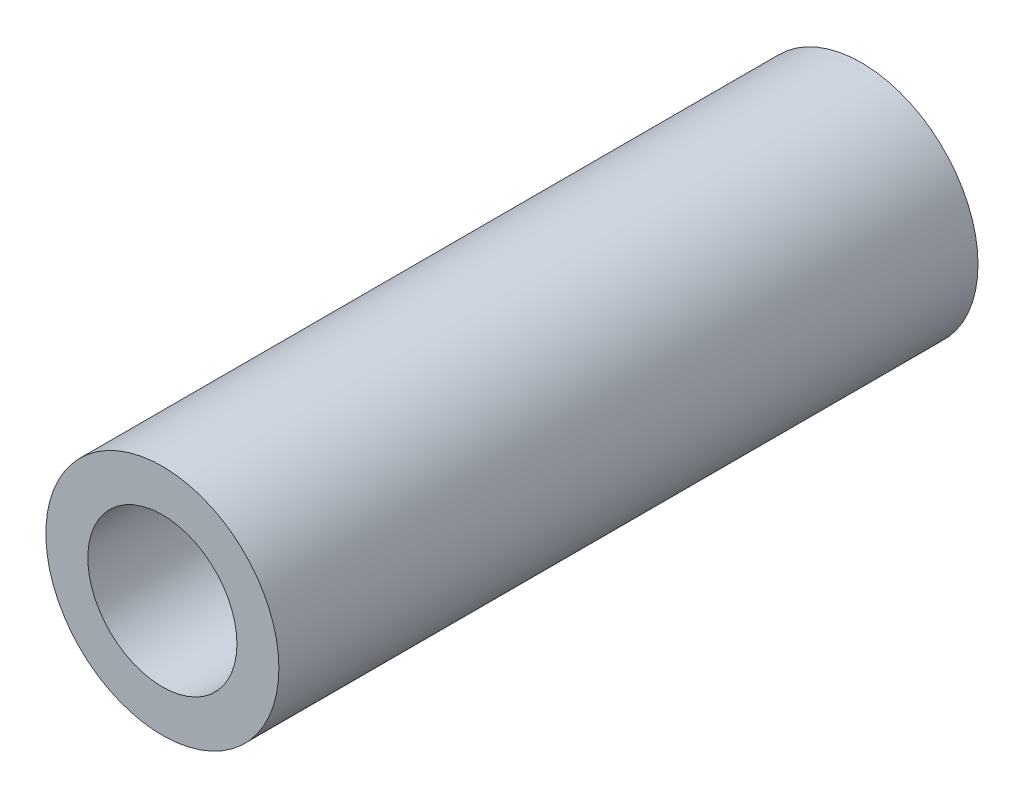
from build123d import *

# Parameters (mm, degrees)
SKETCH_1_R      = 5
SKETCH_1_R_2    = 3.2
EXTRUDE_1_DEPTH = 30


with BuildPart() as part:
    # 草图1 → 凸台-拉伸1 (new body)
    with BuildSketch(Plane.XY):
        Circle(SKETCH_1_R)
        Circle(SKETCH_1_R_2, mode=Mode.SUBTRACT)
    extrude(amount=EXTRUDE_1_DEPTH)


solid = part.part
